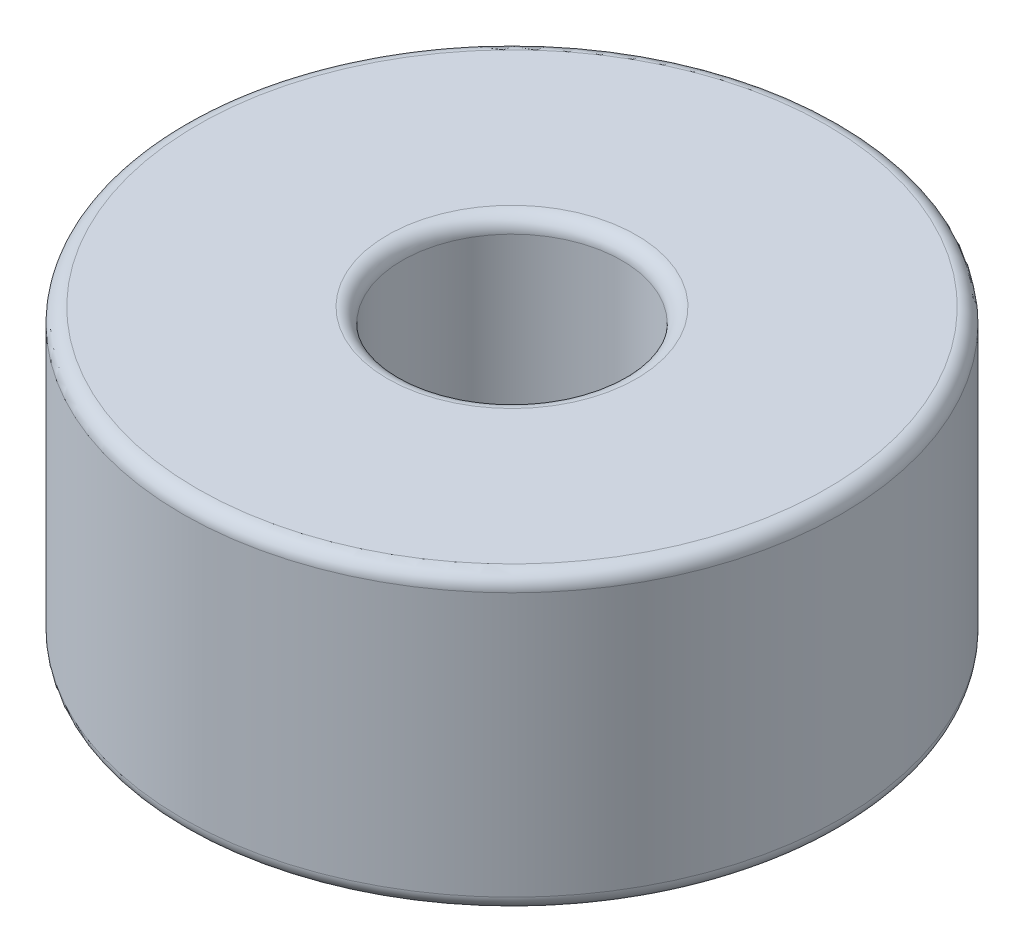
from build123d import *

# Parameters (mm, degrees)
SKETCH1_R           = 45
SKETCH1_R_2         = 15
BOSS_EXTRUDE1_DEPTH = 40
FILLET1_R           = 2


with BuildPart() as part:
    # Sketch1 → Boss-Extrude1 (new body)
    with BuildSketch(Plane(origin=(0, 0, 0), x_dir=(1, 0, 0), z_dir=(0, 1, 0))):
        with Locations(Location((0, 0, 0), (0, 0, 270))):
            Circle(SKETCH1_R)
        with Locations(Location((0, 0, 0), (0, 0, 270))):
            Circle(SKETCH1_R_2, mode=Mode.SUBTRACT)
    extrude(amount=BOSS_EXTRUDE1_DEPTH)

    # Fillet1
    fillet1_edges = [part.edges().sort_by_distance(p)[0] for p in [
        (0, 0, -45),
        (0, 40, -45),
        (0, 0, -15),
        (0, 40, -15),
    ]]
    fillet(fillet1_edges, radius=FILLET1_R)


solid = part.part
